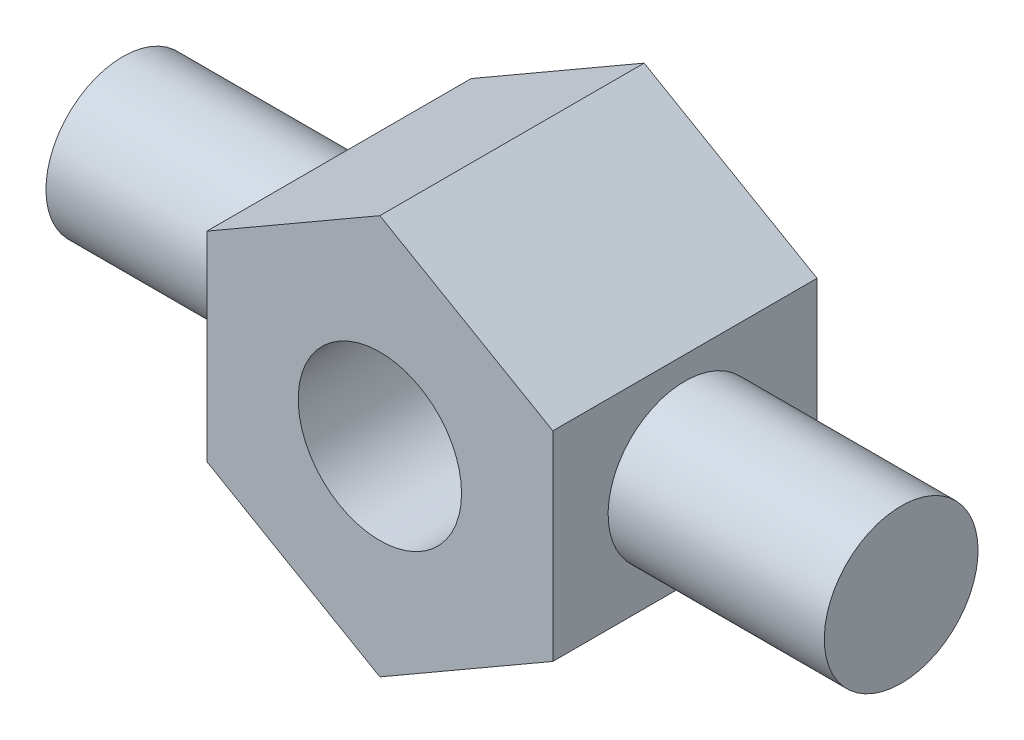
from build123d import *

# Parameters (mm, degrees)
IZIM1_R                     = 8.5
Y_KSEKLIK_EKSTR_ZYON1_DEPTH = 27.5
IZIM2_R                     = 8
Y_KSEKLIK_EKSTR_ZYON3_DEPTH = 22.5


with BuildPart() as part:
    # Çizim1 → Yükseklik-Ekstrüzyon1 (new body)
    with BuildSketch(Plane.XY):
        Polygon((0, 20.784609691), (-18, 10.392304845), (-18, -10.392304845), (0, -20.784609691), (18, -10.392304845), (18, 10.392304845), align=None)
        Circle(IZIM1_R, mode=Mode.SUBTRACT)
    extrude(amount=Y_KSEKLIK_EKSTR_ZYON1_DEPTH)

    # Çizim2 → Yükseklik-Ekstrüzyon3 (add)
    with BuildSketch(Plane(origin=(18, 0, 0), x_dir=(0, 0, -1), z_dir=(1, 0, 0))):
        with Locations(Location((-13.75, 0, 0), (0, 0, 270))):
            Circle(IZIM2_R)
    y_kseklik_ekstr_zyon3 = extrude(amount=Y_KSEKLIK_EKSTR_ZYON3_DEPTH)

    # Aynalama1: Yükseklik-Ekstrüzyon3 across plane
    add(y_kseklik_ekstr_zyon3.mirror(Plane(origin=(0, 0, 0), x_dir=(0, 0, 1), z_dir=(1, 0, 0))))


solid = part.part
